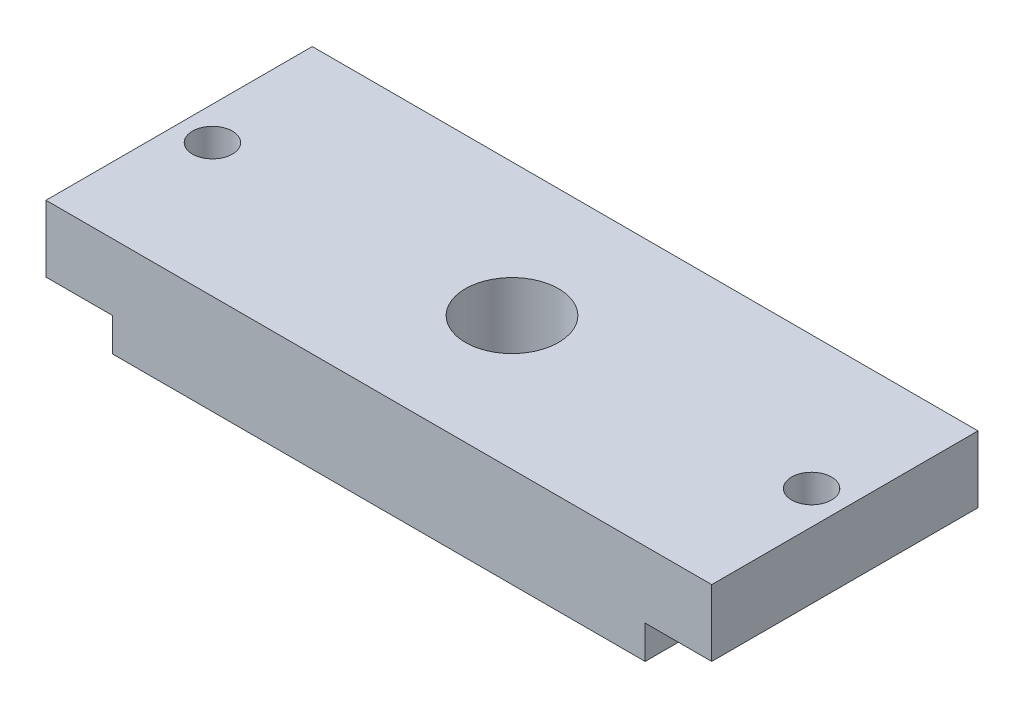
from build123d import *

# Parameters (mm, degrees)
EXTRUSION1_DEPTH        = 20
ESQUISSE2_R             = 3.5
ENL_V_MAT_EXTRU_1_DEPTH = 20
ESQUISSE3_R             = 1.5
ENL_V_MAT_EXTRU_2_DEPTH = 10


with BuildPart() as part:
    # Esquisse1 → Extrusion1 (new body)
    with BuildSketch(Plane.XY):
        Polygon((0, 0), (-50, 0), (-50, -5), (-45, -5), (-45, -7.5), (-5, -7.5), (-5, -5), (0, -5), align=None)
    extrude(amount=EXTRUSION1_DEPTH)

    # Esquisse2 → Enlèv. mat.-Extru.1 (cut)
    with BuildSketch(Plane(origin=(0, 0, 0), x_dir=(1, 0, 0), z_dir=(0, 1, 0))):
        with Locations(Location((-25, -10, 0), (0, 0, 180))):
            Circle(ESQUISSE2_R)
    extrude(amount=-ENL_V_MAT_EXTRU_1_DEPTH, mode=Mode.SUBTRACT)

    # Esquisse3 → Enlèv. mat.-Extru.2 (cut)
    with BuildSketch(Plane.XZ.offset(5)):
        with Locations(Location((-47.5, 10, 0), (0, 0, 270))):
            Circle(ESQUISSE3_R)
        with Locations((-2.5, 10)):
            Circle(ESQUISSE3_R)
    extrude(amount=-ENL_V_MAT_EXTRU_2_DEPTH, mode=Mode.SUBTRACT)


solid = part.part
